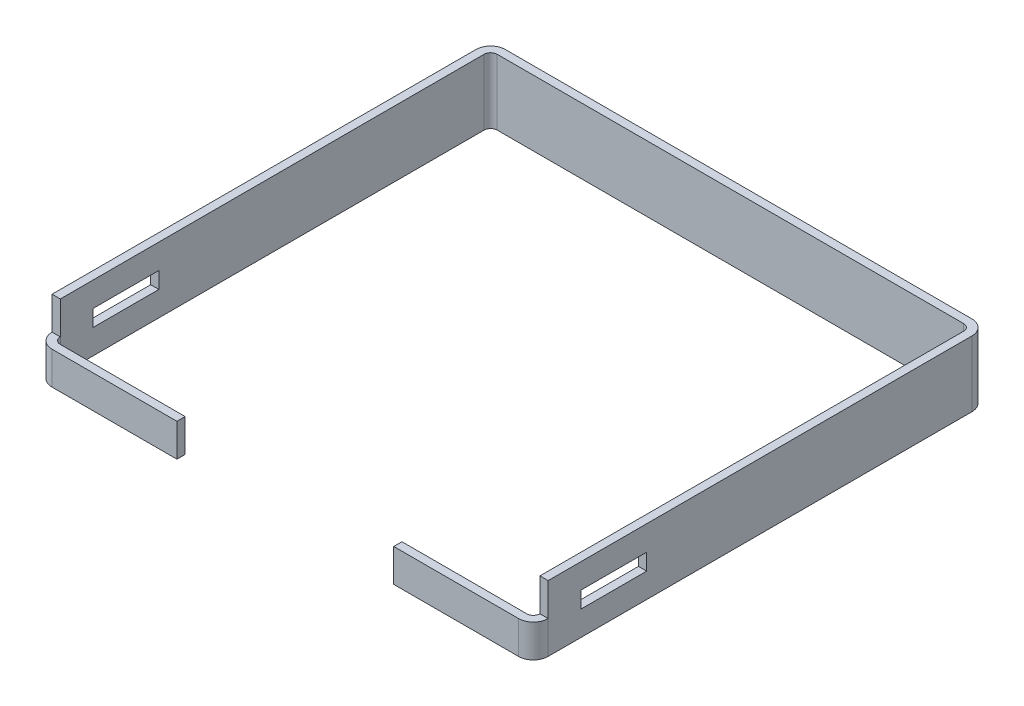
from build123d import *

# Parameters (mm, degrees)
BOSS_EXTRUDE1_DEPTH = 25.4
FILLET1_R           = 2.54
FILLET2_R           = 5.715
SKETCH2_W           = 191.77
SKETCH2_H           = 5.715
CUT_EXTRUDE1_DEPTH  = 12.7
CUT_EXTRUDE2_REACH  = 260.91
SKETCH3_W           = 25.4
SKETCH3_H           = 6.35


with BuildPart() as part:
    # Sketch1 → Boss-Extrude1 (new body)
    with BuildSketch(Plane(origin=(0, 0, 0), x_dir=(1, 0, 0), z_dir=(0, 1, 0))):
        Polygon((-92.71, 0), (92.71, 0), (92.71, -168.91), (41.91, -168.91), (41.91, -172.085), (95.885, -172.085), (95.885, 3.175), (-95.885, 3.175), (-95.885, -172.085), (-41.91, -172.085), (-41.91, -168.91), (-92.71, -168.91), align=None)
    extrude(amount=BOSS_EXTRUDE1_DEPTH)

    # Fillet1
    fillet1_edges = [part.edges().sort_by_distance(p)[0] for p in [
        (92.71, 12.7, 168.91),
        (92.71, 12.7, 0),
        (-92.71, 12.7, 0),
        (-92.71, 12.7, 168.91),
    ]]
    fillet(fillet1_edges, radius=FILLET1_R)

    # Fillet2
    fillet2_edges = [part.edges().sort_by_distance(p)[0] for p in [
        (-95.885, 12.7, -3.175),
        (95.885, 12.7, -3.175),
        (95.885, 12.7, 172.085),
        (-95.885, 12.7, 172.085),
    ]]
    fillet(fillet2_edges, radius=FILLET2_R)

    # Sketch2 → Cut-Extrude1 (cut)
    with BuildSketch(Plane(origin=(0, 25.4, 0), x_dir=(1, 0, 0), z_dir=(0, 1, 0))):
        with Locations((0, -169.2275)):
            Rectangle(SKETCH2_W, SKETCH2_H)
    extrude(amount=-CUT_EXTRUDE1_DEPTH, mode=Mode.SUBTRACT)

    # Cut-Extrude2: up to this face of the body (flat: up to its plane)
    cut_extrude2_end = Plane(part.part.faces().sort_by_distance((95.885, 12.7, 84.455))[0])
    # Sketch3 → Cut-Extrude2 (cut, up to the picked face)
    with BuildSketch(Plane.ZY.offset(95.885), mode=Mode.PRIVATE) as cut_extrude2_sk1:
        with Locations((140.97, 12.7)):
            Rectangle(SKETCH3_W, SKETCH3_H)
    cut_extrude2_tool1 = split(extrude(cut_extrude2_sk1.sketch, amount=-CUT_EXTRUDE2_REACH, mode=Mode.PRIVATE), bisect_by=cut_extrude2_end, keep=Keep.BOTH, mode=Mode.PRIVATE)
    add(cut_extrude2_tool1.solids().sort_by(Axis((-95.885, 12.7, 140.97), (1, 0, 0)))[0], mode=Mode.SUBTRACT)


solid = part.part
